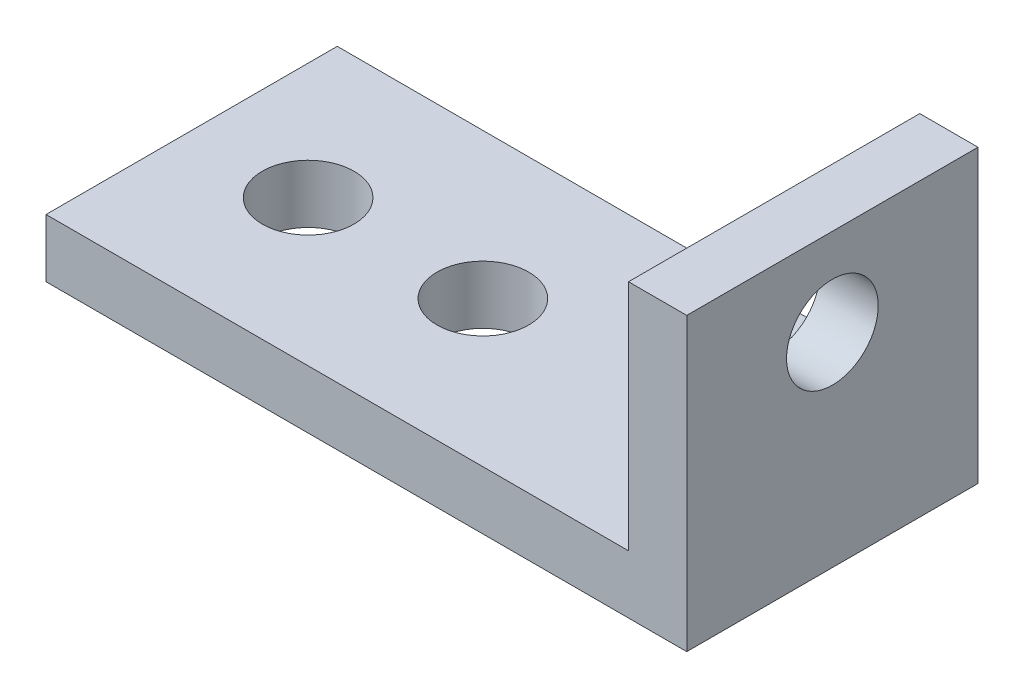
from build123d import *

# Parameters (mm, degrees)
BOSS_EXTRUDE1_DEPTH = 12.7
SKETCH3_R           = 2
CUT_EXTRUDE1_DEPTH  = 33.328922036
SKETCH2_R           = 2
CUT_EXTRUDE2_DEPTH  = 32.108519733


with BuildPart() as part:
    # Sketch1 → Boss-Extrude1 (new body)
    with BuildSketch(Plane.XY):
        Polygon((0, 0), (0, 2.54), (25.4, 2.54), (25.4, 12.7), (27.94, 12.7), (27.94, 0), align=None)
    extrude(amount=BOSS_EXTRUDE1_DEPTH)

    # Sketch3 → Cut-Extrude1 (cut, through all)
    with BuildSketch(Plane(origin=(0, 2.54, 0), x_dir=(1, 0, 0), z_dir=(0, 1, 0))):
        with Locations(Location((5.08, -6.35, 0), (0, 0, 270))):
            Circle(SKETCH3_R)
        with Locations(Location((12.7, -6.35, 0), (0, 0, 270))):
            Circle(SKETCH3_R)
    extrude(amount=-CUT_EXTRUDE1_DEPTH, mode=Mode.SUBTRACT)

    # Sketch2 → Cut-Extrude2 (cut, through all)
    with BuildSketch(Plane.ZY.offset(-25.4)):
        with Locations((6.35, 8.89)):
            Circle(SKETCH2_R)
    extrude(amount=-CUT_EXTRUDE2_DEPTH, mode=Mode.SUBTRACT)


solid = part.part
